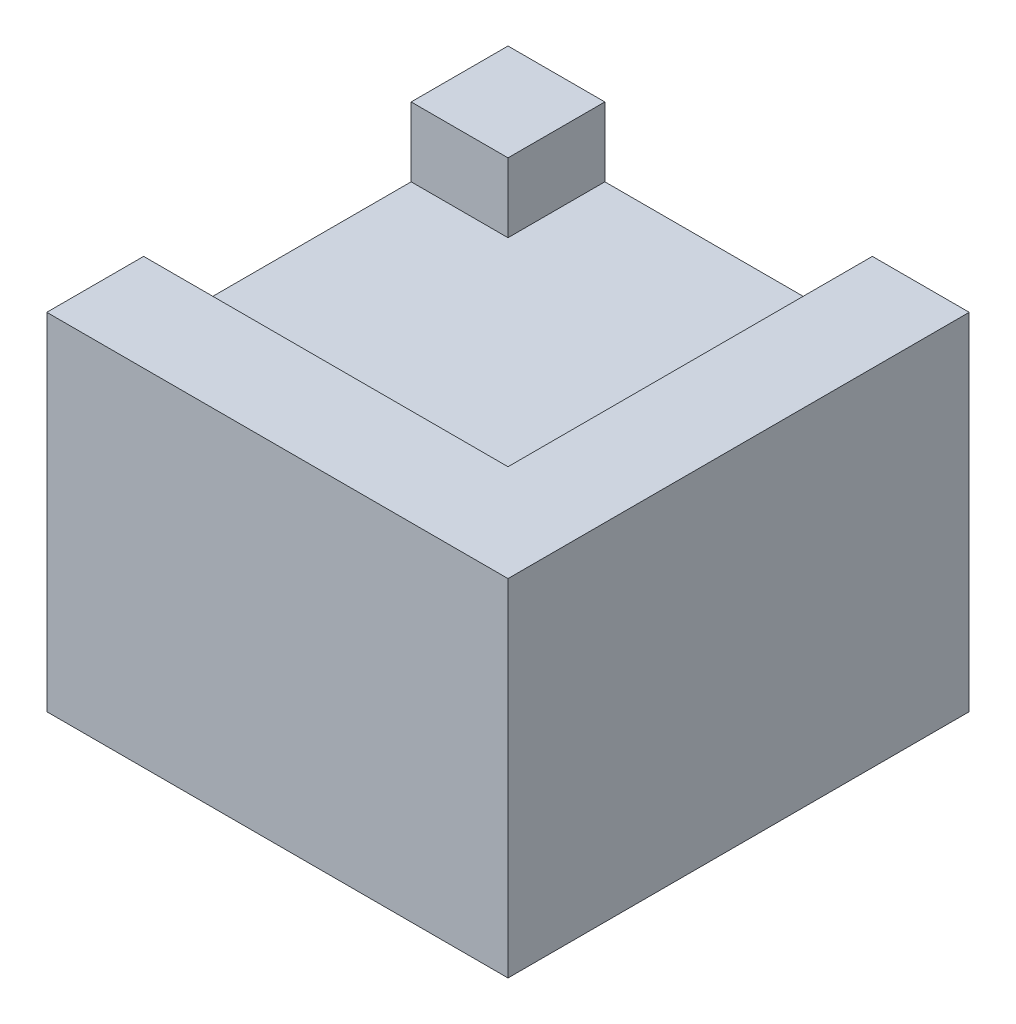
from build123d import *

# Parameters (mm, degrees)
SKETCH1_W           = 31.75
SKETCH1_H           = 31.75
BOSS_EXTRUDE1_DEPTH = 19.05
SKETCH2_W           = 6.6675
SKETCH2_H           = 6.6675
BOSS_EXTRUDE2_DEPTH = 4.7625


with BuildPart() as part:
    # Sketch1 → Boss-Extrude1 (new body)
    with BuildSketch(Plane(origin=(0, 0, 0), x_dir=(1, 0, 0), z_dir=(0, 1, 0))):
        Rectangle(SKETCH1_W, SKETCH1_H)
    extrude(amount=BOSS_EXTRUDE1_DEPTH)

    # Sketch2 → Boss-Extrude2 (add)
    with BuildSketch(Plane(origin=(0, 19.05, 0), x_dir=(1, 0, 0), z_dir=(0, 1, 0))):
        with Locations((-12.54125, 12.54125)):
            Rectangle(SKETCH2_W, SKETCH2_H)
        Polygon((-15.875, -9.2075), (9.2075, -9.2075), (9.2075, 15.875), (15.875, 15.875), (15.875, -15.875), (-15.875, -15.875), align=None)
    extrude(amount=BOSS_EXTRUDE2_DEPTH)


solid = part.part
